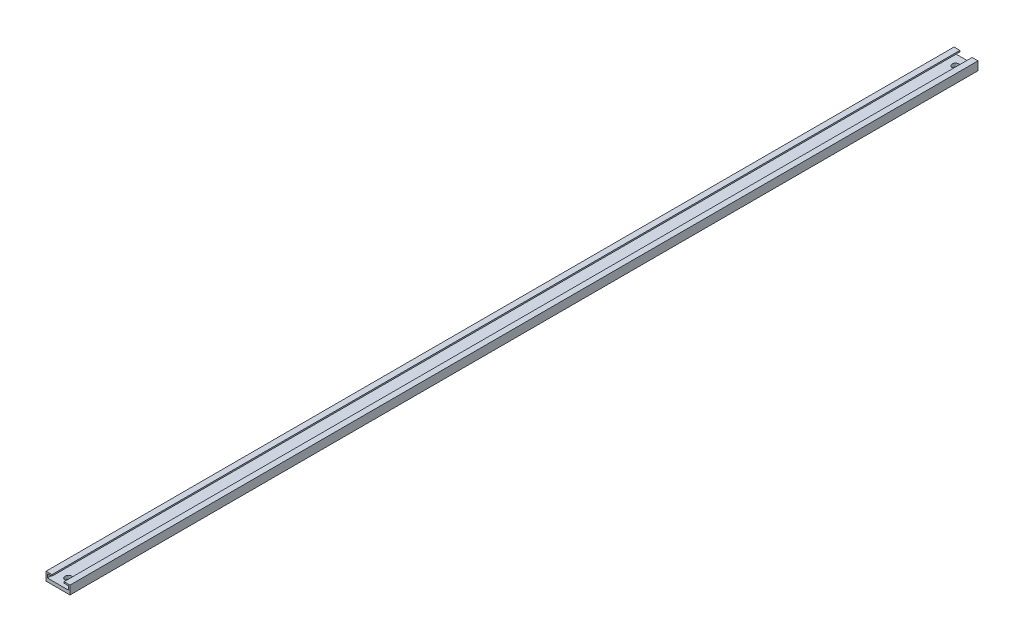
from build123d import *

# Parameters (mm, degrees)
EXTRUDE_1_DEPTH     = 655
CUT_EXTRUDE_1_REACH = 657.086
SKETCH_2_R          = 2.4


with BuildPart() as part:
    # ｽｹｯﾁ1 → ﾎﾞｽ - 押し出し1 (new body)
    with BuildSketch(Plane.XY):
        Polygon((-4.4, 3.1), (-4.4, 2.1), (-7.65, 2.1), (-7.65, -0.6), (7.65, -0.6), (7.65, 2.1), (4.4, 2.1), (4.4, 3.1), (8.65, 3.1), (8.65, -3.1), (-8.65, -3.1), (-8.65, 3.1), align=None)
    extrude(amount=EXTRUDE_1_DEPTH)

    # ｽｹｯﾁ2 → ｶｯﾄ - 押し出し1 (cut, up to next)
    with BuildSketch(Plane(origin=(0, -3.1, 0), x_dir=(-1, 0, 0), z_dir=(0, -1, 0)), mode=Mode.PRIVATE) as cut_extrude_1_sk1:
        with Locations(Location((0, -647.5, 0), (0, 0, 180))):
            Circle(SKETCH_2_R)
    cut_extrude_1_tool1 = extrude(cut_extrude_1_sk1.sketch, amount=-CUT_EXTRUDE_1_REACH, mode=Mode.PRIVATE) & part.part
    cut_extrude_1 = cut_extrude_1_tool1.solids().sort_by_distance((0, -3.1, 647.5))[0]
    add(cut_extrude_1, mode=Mode.SUBTRACT)

    # ﾐﾗｰ1: ｶｯﾄ - 押し出し1 across plane
    add(cut_extrude_1.mirror(Plane.XY.offset(327.5)), mode=Mode.SUBTRACT)


solid = part.part
